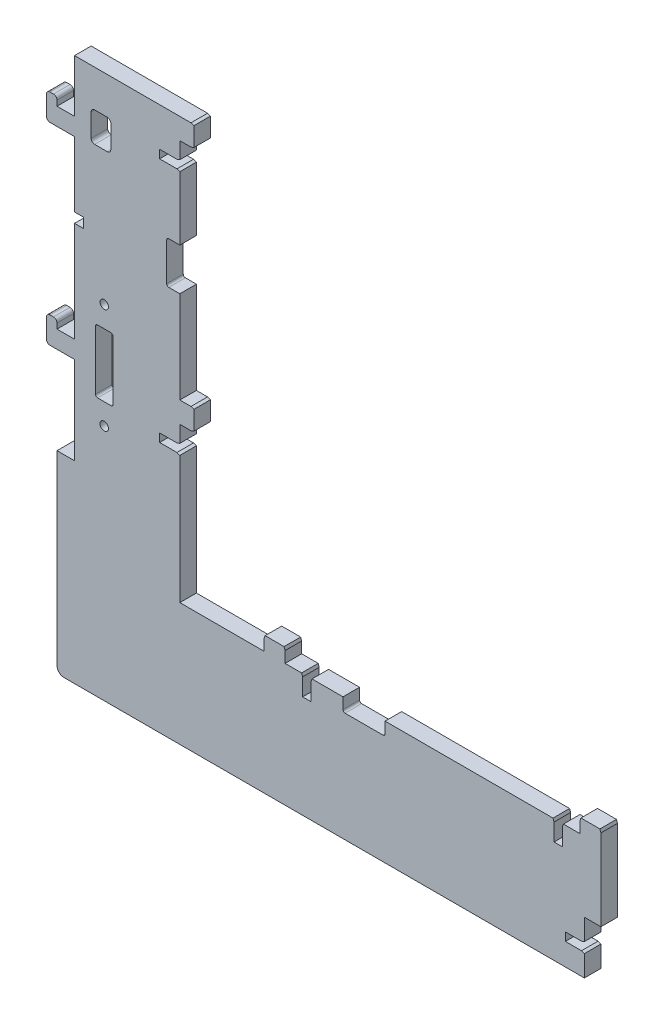
from build123d import *
from OCP.BRepFilletAPI import BRepFilletAPI_MakeChamfer

# Parameters (mm, degrees)
BOSS_EXTRUDE1_DEPTH = 6
SKETCH2_W           = 6.35
SKETCH2_H           = 69.85
SKETCH2_W_2         = 7.62
SKETCH2_H_2         = 5.08
SKETCH2_W_3         = 5.08
SKETCH2_H_3         = 7.62
BOSS_EXTRUDE2_DEPTH = 6
FILLET1_R           = 1.27
SKETCH3_W           = 6
SKETCH3_H           = 19.05
CUT_EXTRUDE1_DEPTH  = 275.000314781
FILLET2_R           = 2.54
SKETCH4_W           = 7.112
SKETCH4_H           = 10.795
SKETCH4_W_2         = 3.175
SKETCH4_H_2         = 3.556
CUT_EXTRUDE2_DEPTH  = 275.000314781
FILLET3_R           = 1.27
SKETCH5_R           = 1.524
SKETCH5_W           = 6.35
SKETCH5_H           = 22.86
CUT_EXTRUDE3_DEPTH  = 275.000314781
SKETCH6_W           = 7.3152
SKETCH6_H           = 2.9972
SKETCH6_W_2         = 2.9972
SKETCH6_H_2         = 7.3152
SKETCH6_W_3         = 6.858
SKETCH6_W_4         = 4.7625
SKETCH6_H_3         = 15.24
SKETCH6_W_5         = 15.24
SKETCH6_H_4         = 4.7625
CUT_EXTRUDE4_DEPTH  = 275.000314781
FILLET4_R           = 0.762
CHAMFER1_SIZE       = 0.381
CHAMFER1_SIZE2      = 1.046788897
CHAMFER2_SIZE       = 0.381
CHAMFER2_SIZE2      = 1.046788897


with BuildPart() as part:
    # Sketch1 → Boss-Extrude1 (new body)
    with BuildSketch(Plane.XY):
        Polygon((0, 0), (190.5, 0), (190.5, 44.45), (38.1, 44.45), (38.1, 196.85), (0, 196.85), align=None)
    extrude(amount=BOSS_EXTRUDE1_DEPTH)

    # Sketch2 → Boss-Extrude2 (add)
    with BuildSketch(Plane.XY.offset(6)):
        Polygon((0, 177.8), (-6.35, 177.8), (-6.35, 180.975), (-10.16, 180.975), (-10.16, 171.45), (0, 171.45), align=None)
        with Locations((-3.175, 34.925)):
            Rectangle(SKETCH2_W, SKETCH2_H)
        Polygon((0, 107.95), (-6.35, 107.95), (-6.35, 111.125), (-10.16, 111.125), (-10.16, 101.6), (0, 101.6), align=None)
        with Locations((72.39, 46.99)):
            Rectangle(SKETCH2_W_2, SKETCH2_H_2)
        with Locations((186.69, 46.99)):
            Rectangle(SKETCH2_W_2, SKETCH2_H_2)
        with Locations((40.64, 193.04)):
            Rectangle(SKETCH2_W_3, SKETCH2_H_3)
        with Locations((40.64, 104.14)):
            Rectangle(SKETCH2_W_3, SKETCH2_H_3)
    extrude(amount=-BOSS_EXTRUDE2_DEPTH)

    # Fillet1
    fillet1_edges = [part.edges().sort_by_distance(p)[0] for p in [
        (-10.16, 171.45, 3),
        (-10.16, 180.975, 3),
        (-6.35, 180.975, 3),
        (-10.16, 101.6, 3),
        (-10.16, 111.125, 3),
        (-6.35, 111.125, 3),
    ]]
    fillet(fillet1_edges, radius=FILLET1_R)

    # Sketch3 → Cut-Extrude1 (cut, through all)
    with BuildSketch(Plane.XY.offset(6)):
        with Locations((187.5, 9.525)):
            Rectangle(SKETCH3_W, SKETCH3_H)
    extrude(amount=-CUT_EXTRUDE1_DEPTH, mode=Mode.SUBTRACT)

    # Fillet2
    fillet2_edges = [part.edges().sort_by_distance(p)[0] for p in [
        (-6.35, 0, 3),
    ]]
    fillet(fillet2_edges, radius=FILLET2_R)

    # Sketch4 → Cut-Extrude2 (cut, through all)
    with BuildSketch(Plane.XY.offset(6)):
        with Locations((9.556, 178.054)):
            Rectangle(SKETCH4_W, SKETCH4_H)
        with Locations((1.5875, 146.05)):
            Rectangle(SKETCH4_W_2, SKETCH4_H_2)
    extrude(amount=-CUT_EXTRUDE2_DEPTH, mode=Mode.SUBTRACT)

    # Fillet3
    fillet3_edges = [part.edges().sort_by_distance(p)[0] for p in [
        (13.112, 183.4515, 3),
        (13.112, 172.6565, 3),
        (6, 172.6565, 3),
        (6, 183.4515, 3),
    ]]
    fillet(fillet3_edges, radius=FILLET3_R)

    # Sketch5 → Cut-Extrude3 (cut, through all)
    with BuildSketch(Plane.XY.offset(6)):
        with Locations((10.7442, 124.206)):
            Circle(SKETCH5_R)
        with Locations((10.7442, 86.106)):
            Circle(SKETCH5_R)
        with Locations((10.7442, 105.156)):
            Rectangle(SKETCH5_W, SKETCH5_H)
    extrude(amount=-CUT_EXTRUDE3_DEPTH, mode=Mode.SUBTRACT)

    # Sketch6 → Cut-Extrude4 (cut, through all)
    with BuildSketch(Plane.XY.offset(6)):
        with Locations((34.4424, 181.3814)):
            Rectangle(SKETCH6_W, SKETCH6_H)
        with Locations((34.4424, 92.4814)):
            Rectangle(SKETCH6_W, SKETCH6_H)
        with Locations((84.0486, 40.7924)):
            Rectangle(SKETCH6_W_2, SKETCH6_H_2)
        with Locations((175.0314, 40.7924)):
            Rectangle(SKETCH6_W_2, SKETCH6_H_2)
        with Locations((181.071, 9.525)):
            Rectangle(SKETCH6_W_3, SKETCH6_H)
        with Locations((35.71875, 148.87448)):
            Rectangle(SKETCH6_W_4, SKETCH6_H_3)
        with Locations((104.75976, 42.06875)):
            Rectangle(SKETCH6_W_5, SKETCH6_H_4)
    extrude(amount=-CUT_EXTRUDE4_DEPTH, mode=Mode.SUBTRACT)

    # Fillet4
    fillet4_edges = [part.edges().sort_by_distance(p)[0] for p in [
        (7.5692, 93.726, 3),
        (7.5692, 116.586, 3),
        (13.9192, 116.586, 3),
        (13.9192, 93.726, 3),
        (33.3375, 141.25448, 3),
        (33.3375, 156.49448, 3),
        (97.13976, 39.6875, 3),
        (112.37976, 39.6875, 3),
    ]]
    fillet(fillet4_edges, radius=FILLET4_R)

    # Chamfer1: one chamfer whose edges measure the first distance from different faces: ONE call of the kernel's chamfer builder (chamfer() names one face for all edges)
    chamfer1_edges_1 = [part.edges().sort_by_distance(p)[0] for p in [
        (38.1, 182.88, 3),
    ]]
    chamfer1_side_1 = [part.faces().sort_by_distance(p)[0] for p in [
        (38.1, 186.055, 3),
    ]]
    chamfer1_edges_2 = [part.edges().sort_by_distance(p)[0] for p in [
        (38.1, 179.8828, 3),
    ]]
    chamfer1_side_2 = [part.faces().sort_by_distance(p)[0] for p in [
        (38.1, 168.18864, 3),
    ]]
    chamfer1_edges_3 = [part.edges().sort_by_distance(p)[0] for p in [
        (38.1, 93.98, 3),
    ]]
    chamfer1_side_3 = [part.faces().sort_by_distance(p)[0] for p in [
        (38.1, 97.155, 3),
    ]]
    chamfer1_edges_4 = [part.edges().sort_by_distance(p)[0] for p in [
        (38.1, 90.9828, 3),
    ]]
    chamfer1_side_4 = [part.faces().sort_by_distance(p)[0] for p in [
        (38.1, 67.7164, 3),
    ]]
    chamfer1_edges_5 = [part.edges().sort_by_distance(p)[0] for p in [
        (82.55, 44.45, 3),
    ]]
    chamfer1_side_5 = [part.faces().sort_by_distance(p)[0] for p in [
        (79.375, 44.45, 3),
    ]]
    chamfer1_edges_6 = [part.edges().sort_by_distance(p)[0] for p in [
        (85.5472, 44.45, 3),
    ]]
    chamfer1_side_6 = [part.faces().sort_by_distance(p)[0] for p in [
        (91.34348, 44.45, 3),
    ]]
    chamfer1_edges_7 = [part.edges().sort_by_distance(p)[0] for p in [
        (173.5328, 44.45, 3),
    ]]
    chamfer1_side_7 = [part.faces().sort_by_distance(p)[0] for p in [
        (142.95628, 44.45, 3),
    ]]
    chamfer1_edges_8 = [part.edges().sort_by_distance(p)[0] for p in [
        (176.53, 44.45, 3),
    ]]
    chamfer1_side_8 = [part.faces().sort_by_distance(p)[0] for p in [
        (179.705, 44.45, 3),
    ]]
    chamfer1_edges_9 = [part.edges().sort_by_distance(p)[0] for p in [
        (184.5, 11.0236, 3),
    ]]
    chamfer1_side_9 = [part.faces().sort_by_distance(p)[0] for p in [
        (184.5, 15.0368, 3),
    ]]
    chamfer1_edges_10 = [part.edges().sort_by_distance(p)[0] for p in [
        (184.5, 8.0264, 3),
    ]]
    chamfer1_side_10 = [part.faces().sort_by_distance(p)[0] for p in [
        (184.5, 4.0132, 3),
    ]]
    chamfer1 = BRepFilletAPI_MakeChamfer(part.part.solid().wrapped)
    for e in chamfer1_edges_1:
        chamfer1.Add(CHAMFER1_SIZE, CHAMFER1_SIZE2, e.wrapped, chamfer1_side_1[0].wrapped)  # the first distance lies on this face
    for e in chamfer1_edges_2:
        chamfer1.Add(CHAMFER1_SIZE, CHAMFER1_SIZE2, e.wrapped, chamfer1_side_2[0].wrapped)  # the first distance lies on this face
    for e in chamfer1_edges_3:
        chamfer1.Add(CHAMFER1_SIZE, CHAMFER1_SIZE2, e.wrapped, chamfer1_side_3[0].wrapped)  # the first distance lies on this face
    for e in chamfer1_edges_4:
        chamfer1.Add(CHAMFER1_SIZE, CHAMFER1_SIZE2, e.wrapped, chamfer1_side_4[0].wrapped)  # the first distance lies on this face
    for e in chamfer1_edges_5:
        chamfer1.Add(CHAMFER1_SIZE, CHAMFER1_SIZE2, e.wrapped, chamfer1_side_5[0].wrapped)  # the first distance lies on this face
    for e in chamfer1_edges_6:
        chamfer1.Add(CHAMFER1_SIZE, CHAMFER1_SIZE2, e.wrapped, chamfer1_side_6[0].wrapped)  # the first distance lies on this face
    for e in chamfer1_edges_7:
        chamfer1.Add(CHAMFER1_SIZE, CHAMFER1_SIZE2, e.wrapped, chamfer1_side_7[0].wrapped)  # the first distance lies on this face
    for e in chamfer1_edges_8:
        chamfer1.Add(CHAMFER1_SIZE, CHAMFER1_SIZE2, e.wrapped, chamfer1_side_8[0].wrapped)  # the first distance lies on this face
    for e in chamfer1_edges_9:
        chamfer1.Add(CHAMFER1_SIZE, CHAMFER1_SIZE2, e.wrapped, chamfer1_side_9[0].wrapped)  # the first distance lies on this face
    for e in chamfer1_edges_10:
        chamfer1.Add(CHAMFER1_SIZE, CHAMFER1_SIZE2, e.wrapped, chamfer1_side_10[0].wrapped)  # the first distance lies on this face
    add(Compound.cast(chamfer1.Shape()), mode=Mode.REPLACE)

    # Chamfer2: one chamfer whose edges measure the first distance from different faces: ONE call of the kernel's chamfer builder (chamfer() names one face for all edges)
    chamfer2_edges_1 = [part.edges().sort_by_distance(p)[0] for p in [
        (68.58, 49.53, 3),
        (76.2, 49.53, 3),
    ]]
    chamfer2_side_1 = [part.faces().sort_by_distance(p)[0] for p in [
        (72.39, 49.53, 3),
    ]]
    chamfer2_edges_2 = [part.edges().sort_by_distance(p)[0] for p in [
        (190.5, 49.53, 3),
        (182.88, 49.53, 3),
    ]]
    chamfer2_side_2 = [part.faces().sort_by_distance(p)[0] for p in [
        (186.69, 49.53, 3),
    ]]
    chamfer2_edges_3 = [part.edges().sort_by_distance(p)[0] for p in [
        (43.18, 196.85, 3),
        (43.18, 189.23, 3),
    ]]
    chamfer2_side_3 = [part.faces().sort_by_distance(p)[0] for p in [
        (43.18, 193.04, 3),
    ]]
    chamfer2_edges_4 = [part.edges().sort_by_distance(p)[0] for p in [
        (43.18, 107.95, 3),
        (43.18, 100.33, 3),
    ]]
    chamfer2_side_4 = [part.faces().sort_by_distance(p)[0] for p in [
        (43.18, 104.14, 3),
    ]]
    chamfer2 = BRepFilletAPI_MakeChamfer(part.part.solid().wrapped)
    for e in chamfer2_edges_1:
        chamfer2.Add(CHAMFER2_SIZE, CHAMFER2_SIZE2, e.wrapped, chamfer2_side_1[0].wrapped)  # the first distance lies on this face
    for e in chamfer2_edges_2:
        chamfer2.Add(CHAMFER2_SIZE, CHAMFER2_SIZE2, e.wrapped, chamfer2_side_2[0].wrapped)  # the first distance lies on this face
    for e in chamfer2_edges_3:
        chamfer2.Add(CHAMFER2_SIZE, CHAMFER2_SIZE2, e.wrapped, chamfer2_side_3[0].wrapped)  # the first distance lies on this face
    for e in chamfer2_edges_4:
        chamfer2.Add(CHAMFER2_SIZE, CHAMFER2_SIZE2, e.wrapped, chamfer2_side_4[0].wrapped)  # the first distance lies on this face
    add(Compound.cast(chamfer2.Shape()), mode=Mode.REPLACE)


solid = part.part
